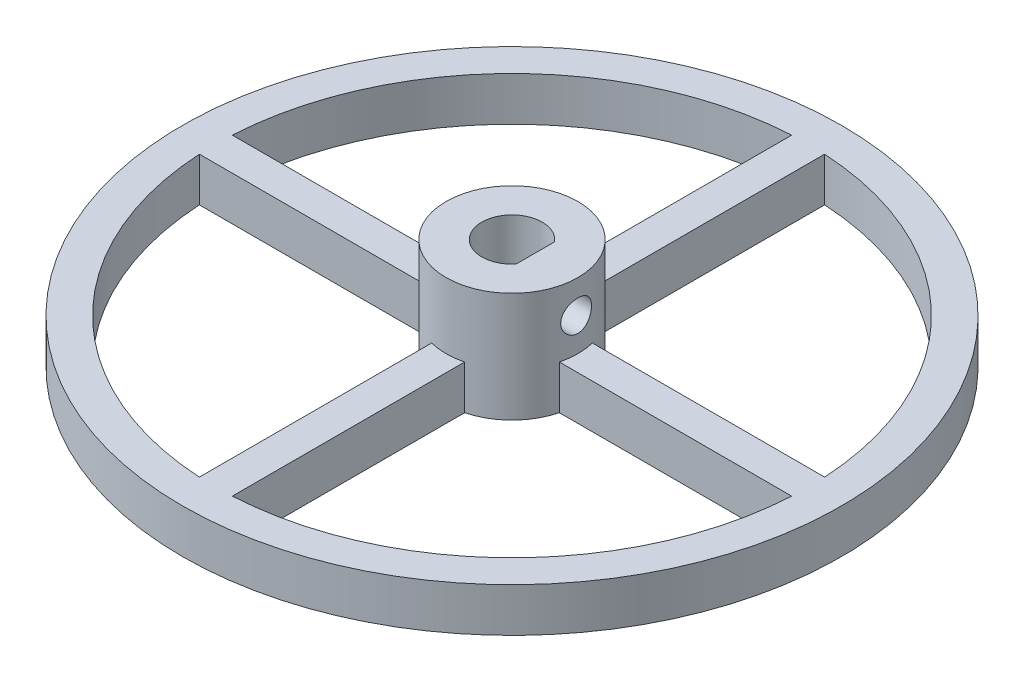
from build123d import *

# Parameters (mm, degrees)
SKETCH1_R           = 30
BOSS_EXTRUDE1_DEPTH = 4
SKETCH2_R           = 6
BOSS_EXTRUDE2_DEPTH = 6
CUT_EXTRUDE1_DEPTH  = 44.588989435
SKETCH4_R           = 1.4
CUT_EXTRUDE2_DEPTH  = 5
CUT_EXTRUDE3_DEPTH  = 44.588989458


with BuildPart() as part:
    # Sketch1 → Boss-Extrude1 (new body)
    with BuildSketch(Plane(origin=(0, 0, 0), x_dir=(1, 0, 0), z_dir=(0, 1, 0))):
        with Locations(Location((0, 0, 0), (0, 0, 270))):
            Circle(SKETCH1_R)
    extrude(amount=BOSS_EXTRUDE1_DEPTH)

    # Sketch2 → Boss-Extrude2 (add)
    with BuildSketch(Plane(origin=(0, 4, 0), x_dir=(1, 0, 0), z_dir=(0, 1, 0))):
        with Locations(Location((0, 0, 0), (0, 0, 270))):
            Circle(SKETCH2_R)
    extrude(amount=BOSS_EXTRUDE2_DEPTH)

    # Sketch3 → Cut-Extrude1 (cut, through all)
    with BuildSketch(Plane(origin=(0, 10, 0), x_dir=(1, 0, 0), z_dir=(0, 1, 0))):
        with BuildLine():
            Line((2.121320344, -1.75), (2.121320344, 1.75))
            ThreePointArc((2.121320344, 1.75), (-2.75, 0), (2.121320344, -1.75))
        make_face()
    extrude(amount=-CUT_EXTRUDE1_DEPTH, mode=Mode.SUBTRACT)

    # Sketch4 → Cut-Extrude2 (cut)
    with BuildSketch(Plane.ZY.offset(-2.121320344)):
        with Locations((0, 7)):
            Circle(SKETCH4_R)
    extrude(amount=-CUT_EXTRUDE2_DEPTH, mode=Mode.SUBTRACT)

    # Sketch5 → Cut-Extrude3 (cut, through all)
    with BuildSketch(Plane(origin=(0, 0, 0), x_dir=(-1, 0, 0), z_dir=(0, -1, 0))):
        with BuildLine():
            ThreePointArc((1.5, -26.958301133), (19.091883092, -19.091883092), (26.958301133, -1.5))
            Line((26.958301133, -1.5), (5.809475019, -1.5))
            ThreePointArc((5.809475019, -1.5), (4.242640687, -4.242640687), (1.5, -5.809475019))
            Line((1.5, -5.809475019), (1.5, -26.958301133))
        make_face()
        with BuildLine():
            ThreePointArc((-26.958301133, -1.5), (-19.091883092, -19.091883092), (-1.5, -26.958301133))
            Line((-1.5, -26.958301133), (-1.5, -5.809475019))
            ThreePointArc((-1.5, -5.809475019), (-4.242640687, -4.242640687), (-5.809475019, -1.5))
            Line((-5.809475019, -1.5), (-26.958301133, -1.5))
        make_face()
        with BuildLine():
            Line((-1.5, 5.809475019), (-1.5, 26.958301133))
            ThreePointArc((-1.5, 26.958301133), (-19.091883092, 19.091883092), (-26.958301133, 1.5))
            Line((-26.958301133, 1.5), (-5.809475019, 1.5))
            ThreePointArc((-5.809475019, 1.5), (-4.242640687, 4.242640687), (-1.5, 5.809475019))
        make_face()
        with BuildLine():
            Line((5.809475019, 1.5), (26.958301133, 1.5))
            ThreePointArc((26.958301133, 1.5), (19.091883092, 19.091883092), (1.5, 26.958301133))
            Line((1.5, 26.958301133), (1.5, 5.809475019))
            ThreePointArc((1.5, 5.809475019), (4.242640687, 4.242640687), (5.809475019, 1.5))
        make_face()
    extrude(amount=-CUT_EXTRUDE3_DEPTH, mode=Mode.SUBTRACT)


solid = part.part
